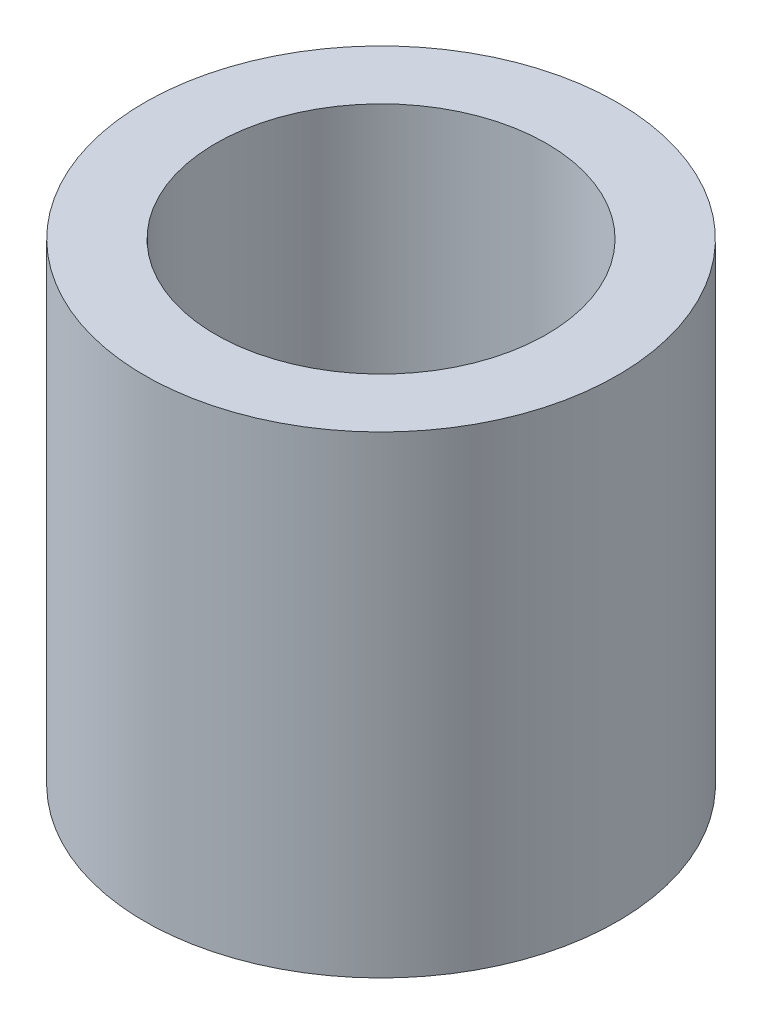
from build123d import *

# Parameters (mm, degrees)
SKETCH1_W = 0.75
SKETCH1_H = 5


with BuildPart() as part:
    # Sketch1 → Revolve1 (revolve)
    with BuildSketch(Plane.XY, mode=Mode.PRIVATE) as revolve1_sk:
        with Locations((-2.125, 2.5)):
            Rectangle(SKETCH1_W, SKETCH1_H)
    revolve(revolve1_sk.sketch.rotate(Axis((0, 0, 0), (0, 1, 0)), 270), axis=Axis((0, 0, 0), (0, 1, 0)))


solid = part.part
